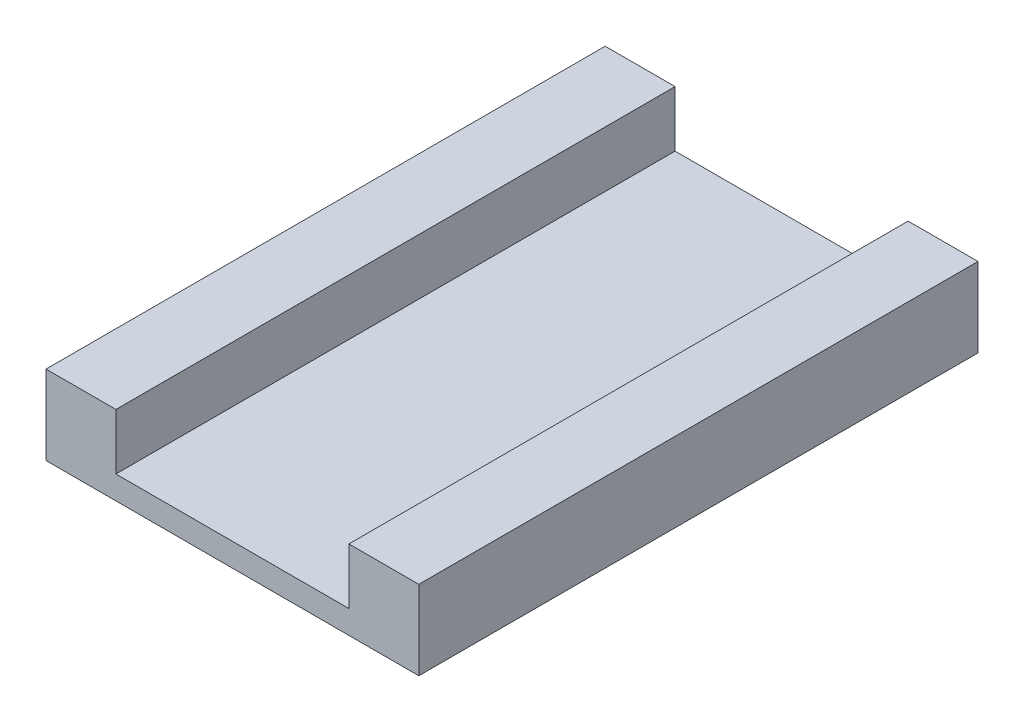
from build123d import *

# Parameters (mm, degrees)
SKETCH1_W           = 40
SKETCH1_H           = 60
BOSS_EXTRUDE1_DEPTH = 8.5
SKETCH2_W           = 25
SKETCH2_H           = 60
CUT_EXTRUDE1_DEPTH  = 6


with BuildPart() as part:
    # Sketch1 → Boss-Extrude1 (new body)
    with BuildSketch(Plane(origin=(0, 0, 0), x_dir=(1, 0, 0), z_dir=(0, 1, 0))):
        with Locations((20, 30)):
            Rectangle(SKETCH1_W, SKETCH1_H)
    extrude(amount=BOSS_EXTRUDE1_DEPTH)

    # Sketch2 → Cut-Extrude1 (cut)
    with BuildSketch(Plane(origin=(0, 8.5, 0), x_dir=(1, 0, 0), z_dir=(0, 1, 0))):
        with Locations((20, 30)):
            Rectangle(SKETCH2_W, SKETCH2_H)
    extrude(amount=-CUT_EXTRUDE1_DEPTH, mode=Mode.SUBTRACT)


solid = part.part
